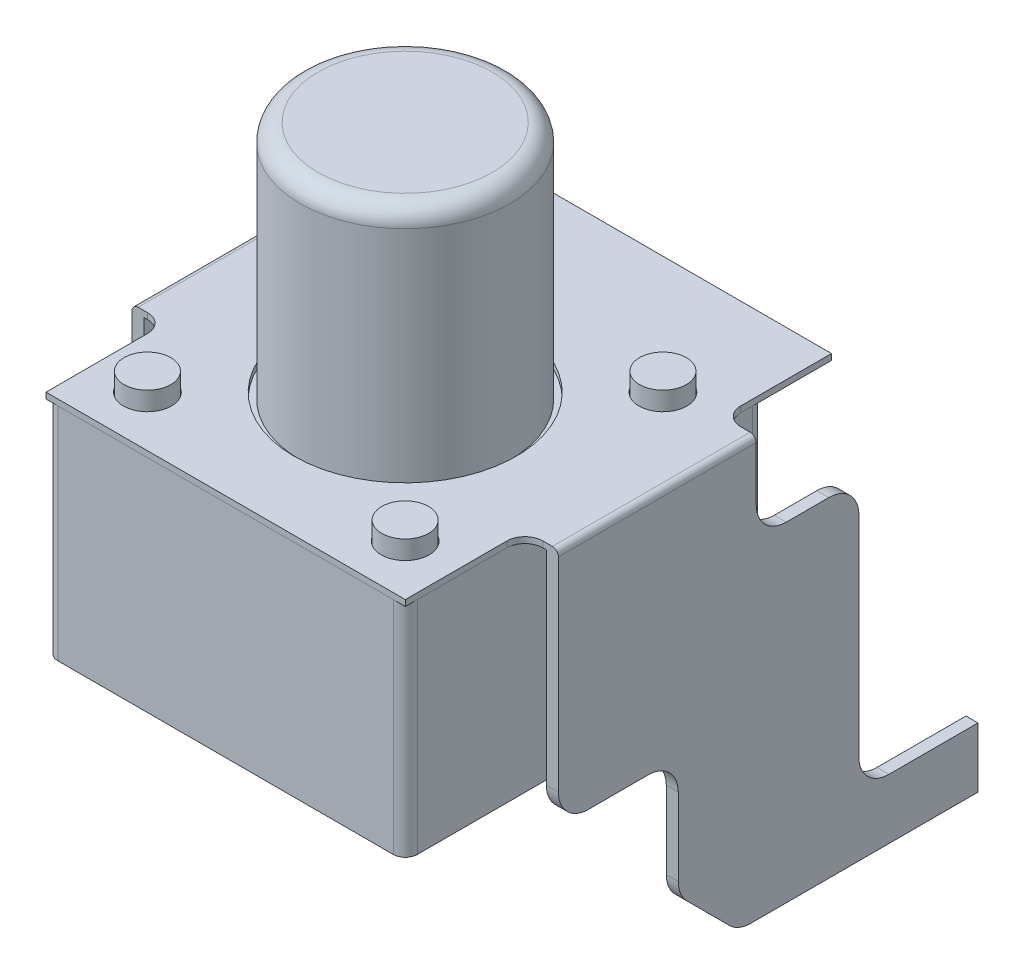
from build123d import *

# Parameters (mm, degrees)
SKETCH1_W           = 5.9944
SKETCH1_H           = 5.99
EXTRUDE1_DEPTH      = 3.683
EXTRUDE2_DEPTH      = 0.2
FILLET3_R           = 0.5
SKETCH6_R           = 1.8526
SKETCH6_R_2         = 0.4
EXTRUDE3_DEPTH      = 0.1
SKETCH2_R           = 1.7526
EXTRUDE4_DEPTH      = 4
FILLET1_R           = 0.1
SKETCH8_R           = 0.39
BOSS_EXTRUDE1_DEPTH = 0.4048
FILLET4_R           = 0.2
FILLET5_R           = 0.3


with BuildPart() as part:
    # Sketch1 → Extrude1 (new body)
    with BuildSketch(Plane(origin=(0, 0, 0), x_dir=(1, 0, 0), z_dir=(0, 1, 0))):
        Rectangle(SKETCH1_W, SKETCH1_H)
    extrude(amount=-EXTRUDE1_DEPTH)

    # Sketch8 → Boss-Extrude1 (add)
    with BuildSketch(Plane(origin=(0, 0, 0), x_dir=(1, 0, 0), z_dir=(0, 1, 0))):
        with Locations(Location((2.15, 2.15, 0), (0, 0, 270))):
            Circle(SKETCH8_R)
        with Locations(Location((2.15, -2.15, 0), (0, 0, 270))):
            Circle(SKETCH8_R)
        with Locations(Location((-2.15, 2.15, 0), (0, 0, 270))):
            Circle(SKETCH8_R)
        with Locations(Location((-2.15, -2.15, 0), (0, 0, 270))):
            Circle(SKETCH8_R)
    extrude(amount=BOSS_EXTRUDE1_DEPTH)

    # Fillet4
    fillet4_edges = [part.edges().sort_by_distance(p)[0] for p in [
        (-2.9972, -1.8415, -2.995),
        (2.9972, -1.8415, -2.995),
        (2.9972, -1.8415, 2.995),
        (-2.9972, -1.8415, 2.995),
    ]]
    fillet(fillet4_edges, radius=FILLET4_R)


with BuildPart() as body_2:
    # Sketch5 → Extrude2 (new body)
    with BuildSketch(Plane(origin=(3.556, 0, 0), x_dir=(0, 0, -1), z_dir=(1, 0, 0))):
        Polygon((2.3, 0.1), (-1, 0.1), (-1, -3.9), (1, -3.9), (1, -5.9), (2, -6.9), (6, -6.9), (6, -5.9), (4.0132, -5.9), (4.0132, -1.4), (2.3, -1.4), align=None)
    extrude(amount=-EXTRUDE2_DEPTH)

    # Fillet3
    fillet3_edges = [body_2.edges().sort_by_distance(p)[0] for p in [
        (3.456, -3.9, 1),
        (3.456, -1.4, -2.3),
        (3.456, -1.4, -4.0132),
        (3.456, -5.9, -4.0132),
        (3.456, -6.9, -2),
        (3.456, -5.9, -1),
        (3.456, -3.9, -1),
    ]]
    fillet(fillet3_edges, radius=FILLET3_R)


with BuildPart() as body_3:
    # Mirror1: mirrored copy
    add(body_2.part.mirror(Plane(origin=(0, 0, 0), x_dir=(0, 0, 1), z_dir=(1, 0, 0))))


with BuildPart() as body_2_1:
    add(body_2.part)

    add(body_3.part)  # Extrude3 merges body 3
    # Sketch6 → Extrude3 (add, through all)
    with BuildSketch(Plane(origin=(0, 0, 0), x_dir=(1, 0, 0), z_dir=(0, 1, 0))):
        with BuildLine():
            Line((3.2972, -1), (3.556, -1))
            Line((3.556, -1), (3.556, 2.3))
            Line((3.556, 2.3), (3.2972, 2.3))
            ThreePointArc((3.2972, 2.3), (3.085067966, 2.387867966), (2.9972, 2.6))
            Line((2.9972, 2.6), (2.9972, 4.115))
            Line((2.9972, 4.115), (-2.9972, 4.115))
            Line((-2.9972, 4.115), (-2.9972, 2.6))
            ThreePointArc((-2.9972, 2.6), (-3.085067966, 2.387867966), (-3.2972, 2.3))
            Line((-3.2972, 2.3), (-3.556, 2.3))
            Line((-3.556, 2.3), (-3.556, -1))
            Line((-3.556, -1), (-3.2972, -1))
            ThreePointArc((-3.2972, -1), (-3.085067966, -1.087867966), (-2.9972, -1.3))
            Line((-2.9972, -1.3), (-2.9972, -2.995))
            Line((-2.9972, -2.995), (2.9972, -2.995))
            Line((2.9972, -2.995), (2.9972, -1.3))
            ThreePointArc((2.9972, -1.3), (3.085067966, -1.087867966), (3.2972, -1))
        make_face()
        with Locations(Location((0, 0, 0), (0, 0, 270))):
            Circle(SKETCH6_R, mode=Mode.SUBTRACT)
        with Locations(Location((-2.15, 2.15, 0), (0, 0, 270))):
            Circle(SKETCH6_R_2, mode=Mode.SUBTRACT)
        with Locations(Location((2.15, 2.15, 0), (0, 0, 270))):
            Circle(SKETCH6_R_2, mode=Mode.SUBTRACT)
        with Locations(Location((2.15, -2.15, 0), (0, 0, 270))):
            Circle(SKETCH6_R_2, mode=Mode.SUBTRACT)
        with Locations(Location((-2.15, -2.15, 0), (0, 0, 270))):
            Circle(SKETCH6_R_2, mode=Mode.SUBTRACT)
    extrude(amount=EXTRUDE3_DEPTH)

    # Fillet1
    fillet1_edges = [body_2_1.edges().sort_by_distance(p)[0] for p in [
        (3.556, 0.1, -0.65),
        (-3.556, 0.1, -0.65),
    ]]
    fillet(fillet1_edges, radius=FILLET1_R)


with BuildPart() as body_3_2:
    # Sketch2 → Extrude4 (new body)
    with BuildSketch(Plane(origin=(0, 0, 0), x_dir=(1, 0, 0), z_dir=(0, 1, 0))):
        with Locations(Location((0, 0, 0), (0, 0, 270))):
            Circle(SKETCH2_R)
    extrude(amount=EXTRUDE4_DEPTH)

    # Fillet5
    fillet5_edges = [body_3_2.edges().sort_by_distance(p)[0] for p in [
        (0, 4, -1.7526),
    ]]
    fillet(fillet5_edges, radius=FILLET5_R)


solid = Compound([part.part, body_2_1.part, body_3_2.part])
